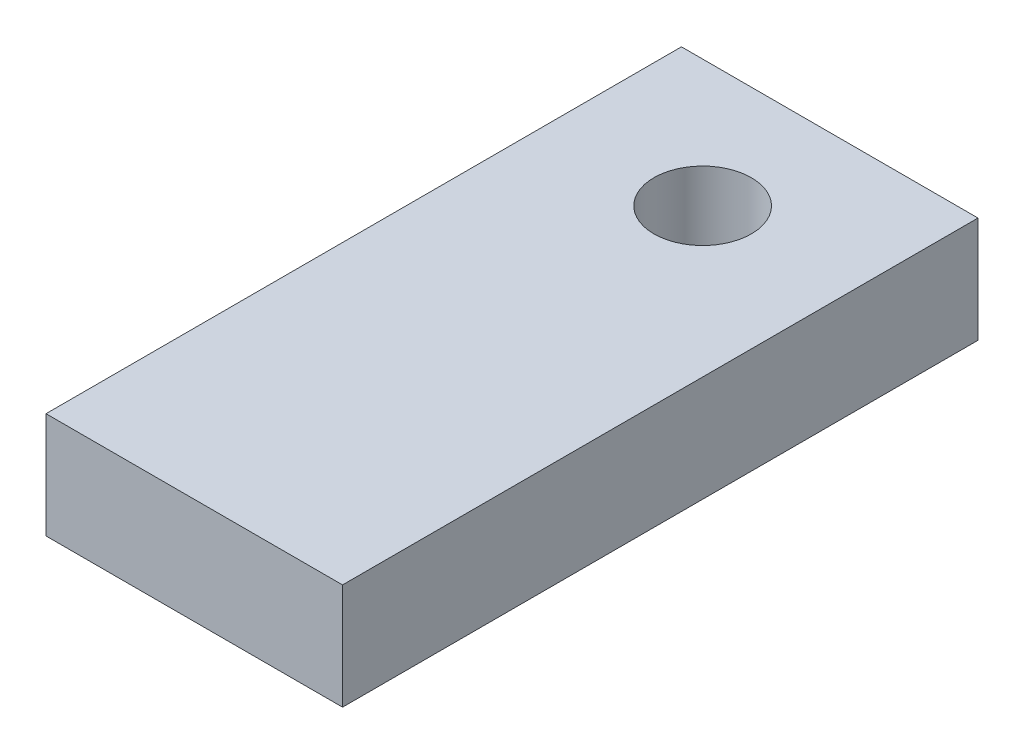
from build123d import *

# Parameters (mm, degrees)
SKETCH1_W           = 8.89
SKETCH1_H           = 19.05
SKETCH1_R           = 1.4605
BOSS_EXTRUDE1_DEPTH = 3.175


with BuildPart() as part:
    # Sketch1 → Boss-Extrude1 (new body)
    with BuildSketch(Plane(origin=(0, 0, 0), x_dir=(1, 0, 0), z_dir=(0, 1, 0))):
        with Locations((4.445, 9.525)):
            Rectangle(SKETCH1_W, SKETCH1_H)
        with Locations(Location((4.445, 15.24, 0), (0, 0, 270))):
            Circle(SKETCH1_R, mode=Mode.SUBTRACT)
    extrude(amount=BOSS_EXTRUDE1_DEPTH)


solid = part.part
